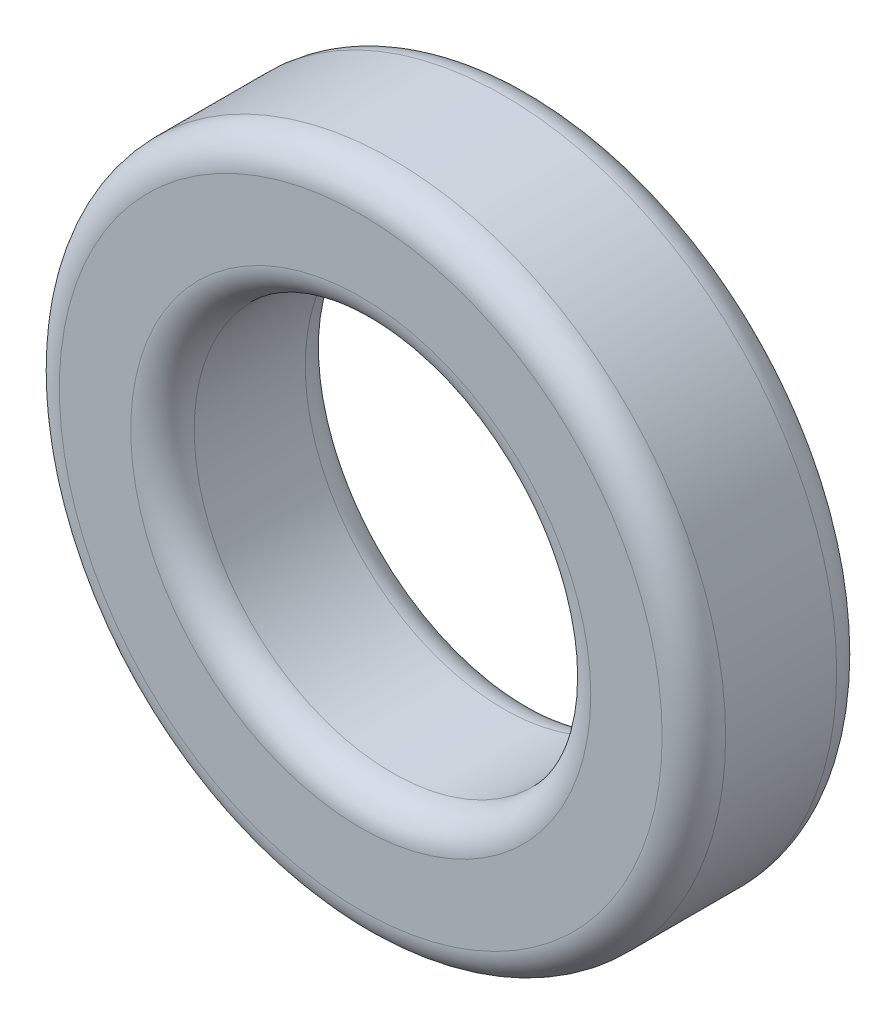
from build123d import *

# Parameters (mm, degrees)
SKETCH_1_R      = 21
SKETCH_1_R_2    = 12.5
EXTRUDE_1_DEPTH = 11
FILLET_1_R      = 2


with BuildPart() as part:
    # 草图1 → 凸台-拉伸1 (new body)
    with BuildSketch(Plane.XY):
        Circle(SKETCH_1_R)
        Circle(SKETCH_1_R_2, mode=Mode.SUBTRACT)
    extrude(amount=EXTRUDE_1_DEPTH)

    # 圆角1
    fillet_1_edges = [part.edges().sort_by_distance(p)[0] for p in [
        (-21, 0, 0),
        (-21, 0, 11),
        (-12.5, 0, 0),
        (-12.5, 0, 11),
    ]]
    fillet(fillet_1_edges, radius=FILLET_1_R)


solid = part.part
